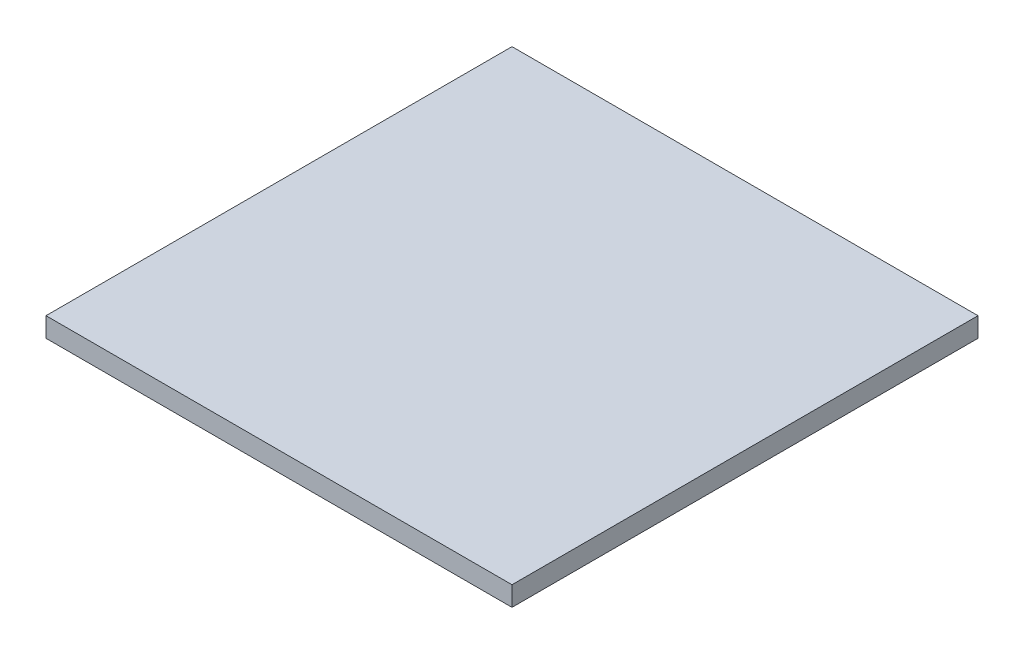
from build123d import *

# Parameters (mm, degrees)
SKETCH1_W           = 404
SKETCH1_H           = 404
SKETCH1_W_2         = 400
SKETCH1_H_2         = 400
BOSS_EXTRUDE1_DEPTH = 15
SKETCH3_W           = 404
SKETCH3_H           = 404
BOSS_EXTRUDE2_DEPTH = 2


with BuildPart() as part:
    # Sketch1 → Boss-Extrude1 (new body)
    with BuildSketch(Plane(origin=(0, 0, 0), x_dir=(1, 0, 0), z_dir=(0, 1, 0))):
        with Locations((200, 52.080415622)):
            Rectangle(SKETCH1_W, SKETCH1_H)
        with Locations((200, 52.080415622)):
            Rectangle(SKETCH1_W_2, SKETCH1_H_2, mode=Mode.SUBTRACT)
    extrude(amount=BOSS_EXTRUDE1_DEPTH)

    # Sketch3 → Boss-Extrude2 (add)
    with BuildSketch(Plane(origin=(0, 15, 0), x_dir=(1, 0, 0), z_dir=(0, 1, 0))):
        with Locations((200, 52.080415622)):
            Rectangle(SKETCH3_W, SKETCH3_H)
    extrude(amount=BOSS_EXTRUDE2_DEPTH)


solid = part.part
